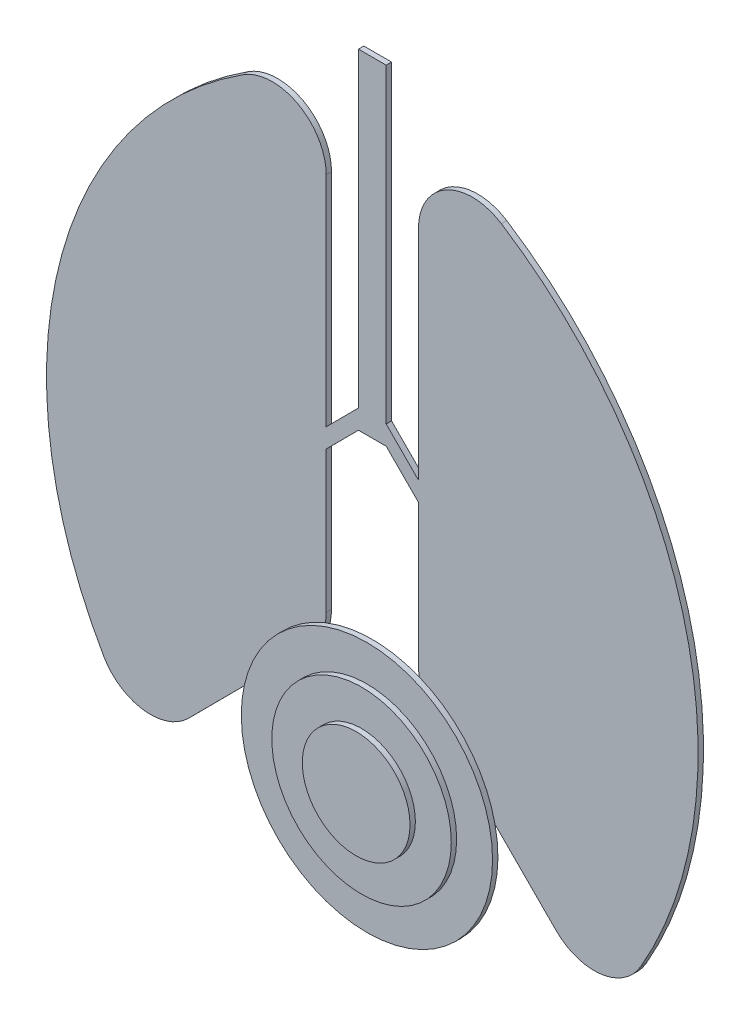
from build123d import *

# Parameters (mm, degrees)
BOSS_EXTRUDE2_DEPTH = 3
SKETCH4_R           = 70
BOSS_EXTRUDE3_DEPTH = 3
SKETCH5_R           = 50
BOSS_EXTRUDE4_DEPTH = 3
SKETCH6_R           = 30
BOSS_EXTRUDE5_DEPTH = 3


with BuildPart() as part:
    # Sketch3 → Boss-Extrude2 (new body)
    with BuildSketch(Plane.XY):
        with BuildLine():
            Line((-7.732951968, 171.945409862), (-7.732951968, 79.732573414))
            Line((-7.732951968, 79.732573414), (-25.727277728, 61.647728335))
            Line((-25.727277728, 61.647728335), (-25.727277728, 183.232578721))
            ThreePointArc((-25.727277728, 183.232578721), (-41.33367569, 209.554133014), (-71.915559085, 208.490043889))
            ThreePointArc((-71.915559085, 208.490043889), (-174.808712355, 64.246349724), (-149.59307925, -111.131574039))
            ThreePointArc((-149.59307925, -111.131574039), (-127.490841861, -125.869970667), (-102.352099339, -117.280857953))
            Line((-102.352099339, -117.280857953), (-34.460919249, -49.048155569))
            ThreePointArc((-34.460919249, -49.048155569), (-27.996511832, -39.333965794), (-25.727277728, -27.888240705))
            Line((-25.727277728, -27.888240705), (-25.727277728, 50.916062024))
            Line((-25.727277728, 50.916062024), (-7.732951969, 69.000907103))
            Line((-7.732951969, 69.000907103), (7.732951969, 69.000907103))
            Line((7.732951969, 69.000907103), (25.727277728, 50.916062024))
            Line((25.727277728, 50.916062024), (25.727277728, -27.888240705))
            ThreePointArc((25.727277728, -27.888240705), (27.996511832, -39.333965794), (34.460919249, -49.048155569))
            Line((34.460919249, -49.048155569), (102.352099339, -117.280857953))
            ThreePointArc((102.352099339, -117.280857953), (127.490841861, -125.869970667), (149.59307925, -111.131574039))
            ThreePointArc((149.59307925, -111.131574039), (174.808712355, 64.246349724), (71.915559085, 208.490043889))
            ThreePointArc((71.915559085, 208.490043889), (41.33367569, 209.554133014), (25.727277728, 183.232578721))
            Line((25.727277728, 183.232578721), (25.727277728, 61.647728335))
            Line((25.727277728, 61.647728335), (7.732951968, 79.732573414))
            Line((7.732951968, 79.732573414), (7.732951968, 171.945409862))
            Line((7.732951968, 171.945409862), (7.732951968, 252.911456322))
            Line((7.732951968, 252.911456322), (-7.732951968, 252.911456322))
            Line((-7.732951968, 252.911456322), (-7.732951968, 171.945409862))
        make_face()
    extrude(amount=-BOSS_EXTRUDE2_DEPTH)

    # Sketch4 → Boss-Extrude3 (add)
    with BuildSketch(Plane.XY):
        with Locations(Location((0, -98.03156951, 0), (0, 0, 167.733969659))):
            Circle(SKETCH4_R)
    extrude(amount=BOSS_EXTRUDE3_DEPTH)

    # Sketch5 → Boss-Extrude4 (add)
    with BuildSketch(Plane.XY.offset(3)):
        with Locations((0, -98.03156951)):
            Circle(SKETCH5_R)
    extrude(amount=BOSS_EXTRUDE4_DEPTH)

    # Sketch6 → Boss-Extrude5 (add)
    with BuildSketch(Plane.XY.offset(6)):
        with Locations((0, -98.03156951)):
            Circle(SKETCH6_R)
    extrude(amount=BOSS_EXTRUDE5_DEPTH)


solid = part.part
